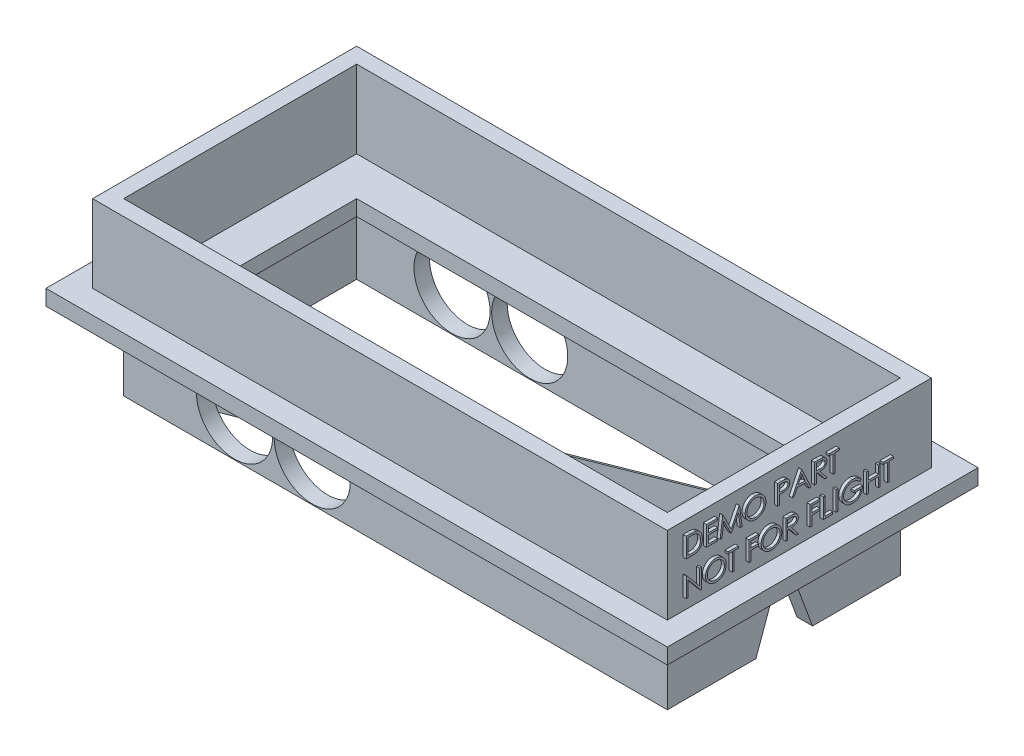
from build123d import *

# Parameters (mm, degrees)
SKETCH1_W           = 350
SKETCH1_H           = 150
SKETCH1_W_2         = 330
SKETCH1_H_2         = 130
BOSS_EXTRUDE1_DEPTH = 50
SKETCH2_W           = 400
SKETCH2_H           = 200
SKETCH2_W_2         = 300
SKETCH2_H_2         = 100
BOSS_EXTRUDE2_DEPTH = 10
SKETCH3_W           = 370
SKETCH3_H           = 170
SKETCH3_W_2         = 350
SKETCH3_H_2         = 150
BOSS_EXTRUDE3_DEPTH = 50
BOSS_EXTRUDE4_DEPTH = 25
SKETCH5_R           = 24.5
CUT_EXTRUDE1_DEPTH  = 25
CUT_EXTRUDE2_START  = -130
SKETCH5_3_R         = 24.5
CUT_EXTRUDE2_DEPTH  = 20
CUT_EXTRUDE3_DEPTH  = 20
SKETCH7_W           = 1.139743589
SKETCH7_H           = 12.7
BOSS_EXTRUDE5_DEPTH = 2


with BuildPart() as part:
    # Sketch1 → Boss-Extrude1 (new body)
    with BuildSketch(Plane(origin=(0, 0, 0), x_dir=(1, 0, 0), z_dir=(0, 1, 0))):
        with Locations((165, 65)):
            Rectangle(SKETCH1_W, SKETCH1_H)
        with Locations((165, 65)):
            Rectangle(SKETCH1_W_2, SKETCH1_H_2, mode=Mode.SUBTRACT)
    extrude(amount=BOSS_EXTRUDE1_DEPTH)

    # Sketch2 → Boss-Extrude2 (add)
    with BuildSketch(Plane(origin=(0, 50, 0), x_dir=(1, 0, 0), z_dir=(0, 1, 0))):
        with Locations((165, 65)):
            Rectangle(SKETCH2_W, SKETCH2_H)
        with Locations((165, 65)):
            Rectangle(SKETCH2_W_2, SKETCH2_H_2, mode=Mode.SUBTRACT)
    extrude(amount=BOSS_EXTRUDE2_DEPTH)

    # Sketch3 → Boss-Extrude3 (add)
    with BuildSketch(Plane(origin=(0, 60, 0), x_dir=(1, 0, 0), z_dir=(0, 1, 0))):
        with Locations((165, 65)):
            Rectangle(SKETCH3_W, SKETCH3_H)
        with Locations((165, 65)):
            Rectangle(SKETCH3_W_2, SKETCH3_H_2, mode=Mode.SUBTRACT)
    extrude(amount=BOSS_EXTRUDE3_DEPTH)

    # Sketch4 → Boss-Extrude4 (add)
    with BuildSketch(Plane.XZ):
        Polygon((0.6988, 0), (330, -129.241932626), (330, -130), (329.194358019, -130), (0, -0.8), (0, 0), align=None)
    extrude(amount=-BOSS_EXTRUDE4_DEPTH)

    # Sketch5 → Cut-Extrude1 (cut)
    with BuildSketch(Plane(origin=(0, 0, -140), x_dir=(-1, 0, 0), z_dir=(0, 0, -1))):
        with Locations((-61.39675889, 24.958245431)):
            Circle(SKETCH5_R)
        with Locations((-111.39675889, 24.958245431)):
            Circle(SKETCH5_R)
    extrude(amount=-CUT_EXTRUDE1_DEPTH, mode=Mode.SUBTRACT)

    # Sketch5<3> → Cut-Extrude2 (cut)
    with BuildSketch(Plane(origin=(0, 0, -140), x_dir=(-1, 0, 0), z_dir=(0, 0, -1)).offset(CUT_EXTRUDE2_START)):
        with Locations((-61.39675889, 24.958245431)):
            Circle(SKETCH5_3_R)
        with Locations((-111.39675889, 24.958245431)):
            Circle(SKETCH5_3_R)
    extrude(amount=-CUT_EXTRUDE2_DEPTH, mode=Mode.SUBTRACT)

    # Sketch6 → Cut-Extrude3 (cut)
    with BuildSketch(Plane(origin=(340, 0, 0), x_dir=(0, 0, -1), z_dir=(1, 0, 0))):
        Polygon((47.05043949, 0), (65, 50), (83.482635595, 0), align=None)
    extrude(amount=-CUT_EXTRUDE3_DEPTH, mode=Mode.SUBTRACT)

    # Sketch7 → Boss-Extrude5 (add)
    # profile 1 of 20: a face of its own
    with BuildSketch(Plane(origin=(350, 0, 0), x_dir=(0, 0, -1), z_dir=(1, 0, 0))):
        with BuildLine():
            Line((-9.81688911, 90.003565289), (-9.81688911, 102.703565289))
            Line((-9.81688911, 102.703565289), (-7.252466033, 102.703565289))
            add(Edge.make_bspline(
                [(-7.252466033, 102.703565289), (-7.029421419, 102.701959392), (-6.598500385, 102.698856808), (-5.975792361, 102.679184903), (-5.399634137, 102.644385212), (-4.87192062, 102.593695789), (-4.391203079, 102.531454781), (-3.958827559, 102.453439028), (-3.572558354, 102.361316239), (-3.334997813, 102.282774176), (-3.222658341, 102.245632597)],
                knots=[0, 0, 0, 0, 1.314313732, 2.53924729, 3.670748893, 4.714932338, 5.66265055, 6.526160246, 7.303039223, 8, 8, 8, 8], degree=3))
            add(Edge.make_bspline(
                [(-3.222658341, 102.245632597), (-3.075720287, 102.189641179), (-2.785176246, 102.078928043), (-2.371493259, 101.870080893), (-1.982055513, 101.633450495), (-1.614774616, 101.368724936), (-1.278040189, 101.068408586), (-0.958697249, 100.74525859), (-0.669809537, 100.387523755), (-0.405256577, 100.002623084), (-0.166730041, 99.595090781), (0.040603474, 99.165703386), (0.212793679, 98.716641517), (0.355734815, 98.24915398), (0.468389104, 97.762212838), (0.545249256, 97.255251095), (0.595943991, 96.730272322), (0.601038691, 96.374039268), (0.60362371, 96.193288847)],
                knots=[0, 0, 0, 0, 0.984719456, 1.947108742, 2.898477687, 3.838006223, 4.779231079, 5.722358779, 6.681677486, 7.655904652, 8.64651281, 9.637519902, 10.640069247, 11.656948941, 12.698408672, 13.768548281, 14.867775369, 16, 16, 16, 16], degree=3))
            add(Edge.make_bspline(
                [(0.60362371, 96.193288847), (0.601341457, 96.036312353), (0.596844038, 95.726973776), (0.556460521, 95.271076812), (0.497763588, 94.82870471), (0.406888927, 94.401964027), (0.296571236, 93.987115922), (0.155187029, 93.588581778), (-0.006776057, 93.20270567), (-0.195642759, 92.834705115), (-0.402984356, 92.486059735), (-0.625494681, 92.157399962), (-0.862936405, 91.853415585), (-1.117573701, 91.57318605), (-1.386115986, 91.317133809), (-1.670321415, 91.083119924), (-1.970923342, 90.875723282), (-2.286575393, 90.686794061), (-2.626485919, 90.521983057), (-2.997093205, 90.382537021), (-3.399977765, 90.266979303), (-3.834150694, 90.170564909), (-4.300362171, 90.094084411), (-4.799069275, 90.042825787), (-5.329505783, 90.008162289), (-5.693739117, 90.005127375), (-5.881212027, 90.003565289)],
                knots=[0, 0, 0, 0, 1.105936401, 2.179363191, 3.223086493, 4.248585256, 5.251745608, 6.245858792, 7.225916811, 8.198733463, 9.158002045, 10.082870192, 10.993790845, 11.873723703, 12.748670949, 13.606408763, 14.465103618, 15.319838547, 16.196477973, 17.123216899, 18.106603292, 19.147568657, 20.255746949, 21.433717677, 22.679120308, 24, 24, 24, 24], degree=3))
            Line((-5.881212027, 90.003565289), (-9.81688911, 90.003565289))
        make_face()
        with BuildLine():
            Line((-8.67714552, 91.306129392), (-7.219393117, 91.306129392))
            add(Edge.make_bspline(
                [(-7.219393117, 91.306129392), (-7.0099216, 91.307029627), (-6.60703116, 91.308761109), (-6.027700713, 91.323954675), (-5.498366903, 91.348781134), (-5.018954568, 91.383524988), (-4.589734395, 91.429493963), (-4.209809359, 91.480747181), (-3.880424851, 91.544600788), (-3.681109465, 91.602479984), (-3.589004495, 91.629226347)],
                knots=[0, 0, 0, 0, 1.375205317, 2.645023457, 3.804390687, 4.853969522, 5.800190428, 6.637939096, 7.370582563, 8, 8, 8, 8], degree=3))
            add(Edge.make_bspline(
                [(-3.589004495, 91.629226347), (-3.473077581, 91.670053429), (-3.243992665, 91.750732441), (-2.914224156, 91.897898812), (-2.606677311, 92.072222893), (-2.315992362, 92.265996859), (-2.046292783, 92.486055209), (-1.794382419, 92.727612797), (-1.560768454, 92.991898981), (-1.347864536, 93.278585738), (-1.157334404, 93.585888711), (-0.9923388, 93.910786765), (-0.847734671, 94.249720048), (-0.734238064, 94.60789328), (-0.645281516, 94.982104435), (-0.582272505, 95.372379838), (-0.543030505, 95.778646603), (-0.538453251, 96.054970026), (-0.536119879, 96.195832917)],
                knots=[0, 0, 0, 0, 0.998632004, 1.973411704, 2.929992603, 3.868527914, 4.809262121, 5.754881198, 6.702106254, 7.672490631, 8.653608572, 9.636854334, 10.631411391, 11.644891563, 12.686317036, 13.754757253, 14.855430412, 16, 16, 16, 16], degree=3))
            add(Edge.make_bspline(
                [(-0.536119879, 96.195832917), (-0.537982379, 96.344362974), (-0.541641277, 96.636151586), (-0.587630917, 97.064289252), (-0.654837704, 97.476061898), (-0.752024222, 97.871497064), (-0.875870554, 98.251366228), (-1.030428254, 98.61356845), (-1.207018558, 98.961928975), (-1.417124952, 99.288407387), (-1.647232962, 99.597173812), (-1.902604125, 99.880038791), (-2.179181236, 100.137646681), (-2.473947689, 100.37400933), (-2.795210878, 100.579617525), (-3.135402842, 100.763537768), (-3.499514277, 100.919624002), (-3.752834631, 101.00264159), (-3.881572604, 101.044831315)],
                knots=[0, 0, 0, 0, 1.122418816, 2.205001699, 3.251619955, 4.274784885, 5.280384055, 6.268708349, 7.249350384, 8.229342522, 9.199999885, 10.157847722, 11.105861043, 12.055065948, 13.010012805, 13.98527497, 14.976112212, 16, 16, 16, 16], degree=3))
            add(Edge.make_bspline(
                [(-3.881572604, 101.044831315), (-3.988075335, 101.074282353), (-4.214529362, 101.136903341), (-4.584061132, 101.20521255), (-4.999950388, 101.26546316), (-5.46404359, 101.31647376), (-5.975811713, 101.353076326), (-6.535648352, 101.380549382), (-7.143795488, 101.399079163), (-7.565372111, 101.400344472), (-7.78417677, 101.401001186)],
                knots=[0, 0, 0, 0, 0.674548936, 1.434276114, 2.292660221, 3.240891867, 4.284742987, 5.42552168, 6.663806718, 8, 8, 8, 8], degree=3))
            Line((-7.78417677, 101.401001186), (-8.67714552, 101.401001186))
            Line((-8.67714552, 101.401001186), (-8.67714552, 91.306129392))
        make_face(mode=Mode.SUBTRACT)
    # profile 2 of 20: a face of its own
    with BuildSketch(Plane(origin=(350, 0, 0), x_dir=(0, 0, -1), z_dir=(1, 0, 0))):
        Polygon((3.208751916, 102.703565289), (10.37285448, 102.703565289), (10.37285448, 101.401001186), (4.348495505, 101.401001186), (4.348495505, 97.493308879), (10.37285448, 97.493308879), (10.37285448, 96.190744776), (4.348495505, 96.190744776), (4.348495505, 91.306129392), (10.37285448, 91.306129392), (10.37285448, 90.003565289), (3.208751916, 90.003565289), align=None)
    # profile 3 of 20: a face of its own
    with BuildSketch(Plane(origin=(350, 0, 0), x_dir=(0, 0, -1), z_dir=(1, 0, 0))):
        Polygon((12.001059608, 90.003565289), (13.677602076, 102.703565289), (13.840422589, 102.703565289), (19.083751916, 92.283052468), (24.31436089, 102.703565289), (24.479725473, 102.703565289), (26.166444223, 90.003565289), (25.021612492, 90.003565289), (23.805546787, 99.141866571), (19.221131723, 90.003565289), (18.964180601, 90.003565289), (14.361957044, 99.162219135), (13.148435409, 90.003565289), align=None)
    # profile 4 of 20: a face of its own
    with BuildSketch(Plane(origin=(350, 0, 0), x_dir=(0, 0, -1), z_dir=(1, 0, 0))):
        with BuildLine():
            add(Edge.make_bspline(
                [(34.714521146, 103.029206315), (34.949681988, 103.023250089), (35.411557282, 103.011551572), (36.090371911, 102.922001682), (36.738416971, 102.76707841), (37.360971475, 102.560747016), (37.950588847, 102.285503961), (38.511707114, 101.952817851), (39.042991199, 101.559203272), (39.537280212, 101.107702935), (39.98960686, 100.616454402), (40.388117933, 100.092205985), (40.72209997, 99.538127474), (40.996368398, 98.955883889), (41.211537639, 98.346792005), (41.360015312, 97.707604623), (41.454859457, 97.042463205), (41.465947563, 96.588794296), (41.471572428, 96.35865343)],
                knots=[0, 0, 0, 0, 1.065120563, 2.091984664, 3.0946048, 4.079830382, 5.057816894, 6.036188127, 7.030412546, 8.04752943, 9.064399622, 10.05169764, 11.02544977, 11.989514704, 12.962713494, 13.945757189, 14.957906945, 16, 16, 16, 16], degree=3))
            add(Edge.make_bspline(
                [(41.471572428, 96.35865343), (41.465948387, 96.130207839), (41.454862751, 95.679915113), (41.359907473, 95.018994616), (41.210987273, 94.383665517), (40.998366536, 93.774988434), (40.725405514, 93.192321274), (40.389199607, 92.637197185), (39.993172928, 92.109434176), (39.542479497, 91.614813934), (39.051167145, 91.161251683), (38.524188748, 90.766031763), (37.973395844, 90.425947082), (37.391700618, 90.154589179), (36.786817627, 89.937702497), (36.153333197, 89.789828668), (35.494215701, 89.694444253), (35.044740916, 89.683491353), (34.816283967, 89.677924263)],
                knots=[0, 0, 0, 0, 1.043624062, 2.057103931, 3.04512605, 4.022047818, 4.998200453, 5.980619268, 6.982898556, 8.009068085, 9.034988726, 10.034168286, 11.015286542, 11.987931943, 12.962482838, 13.94673481, 14.956375938, 16, 16, 16, 16], degree=3))
            add(Edge.make_bspline(
                [(34.816283967, 89.677924263), (34.586144295, 89.683546324), (34.13247774, 89.694628903), (33.466500497, 89.78963), (32.826864113, 89.938188445), (32.215397752, 90.150494114), (31.631760437, 90.424876637), (31.074810708, 90.759446812), (30.546784088, 91.156438439), (30.052058322, 91.606985724), (29.599396946, 92.097465355), (29.204755783, 92.623006795), (28.870110371, 93.173299452), (28.596649136, 93.749870468), (28.380152384, 94.34993256), (28.232452044, 94.977488464), (28.136890161, 95.628960386), (28.125878003, 96.072527474), (28.120290377, 96.297595738)],
                knots=[0, 0, 0, 0, 1.053102029, 2.075944431, 3.073151272, 4.055350789, 5.033113405, 6.020478099, 7.024410459, 8.052272461, 9.079885166, 10.07527673, 11.055994387, 12.023226415, 12.992069828, 13.970394897, 14.97016774, 16, 16, 16, 16], degree=3))
            add(Edge.make_bspline(
                [(28.120290377, 96.297595738), (28.12223034, 96.448662851), (28.126085793, 96.7488913), (28.172501363, 97.194721534), (28.239853821, 97.633381921), (28.336380761, 98.063625075), (28.46262481, 98.484397791), (28.611585024, 98.898601988), (28.793521034, 99.302040071), (28.999190814, 99.696623235), (29.228740803, 100.076200494), (29.482289951, 100.434992124), (29.750932574, 100.776008884), (30.045439745, 101.090413726), (30.356105132, 101.387352994), (30.68796839, 101.662263424), (31.039004533, 101.91762396), (31.410724026, 102.147749198), (31.79396748, 102.355880915), (32.189034645, 102.534485917), (32.590559919, 102.687778769), (33.000423927, 102.812024049), (33.417538272, 102.910111722), (33.842813319, 102.97690412), (34.275910265, 103.023438073), (34.56768848, 103.027275295), (34.714521146, 103.029206315)],
                knots=[0, 0, 0, 0, 1.037015668, 2.060948919, 3.074880161, 4.083647147, 5.086022904, 6.090072063, 7.104153813, 8.122640571, 9.144368836, 10.147691507, 11.138137339, 12.123020368, 13.103399296, 14.087645067, 15.080126199, 16.082011238, 17.087798457, 18.072939717, 19.057185487, 20.037253025, 21.01195951, 21.997135196, 22.992090687, 24, 24, 24, 24], degree=3))
        make_face()
        with BuildLine():
            add(Edge.make_bspline(
                [(34.770490698, 101.726642212), (34.649969027, 101.725173039), (34.410077882, 101.722248738), (34.053445422, 101.683728856), (33.701503262, 101.628828973), (33.354178719, 101.550518883), (33.012925041, 101.443824177), (32.674561331, 101.321030025), (32.342173107, 101.171456353), (32.01685768, 101.002463969), (31.701480122, 100.815415028), (31.403891177, 100.608688901), (31.12332044, 100.387133576), (30.860454872, 100.150231995), (30.616066333, 99.896777725), (30.385344702, 99.630613171), (30.177537935, 99.344130595), (29.98709027, 99.045098548), (29.816664107, 98.733906524), (29.665115534, 98.413830738), (29.541148988, 98.082260275), (29.440048365, 97.742792332), (29.356229052, 97.39596455), (29.303128813, 97.039145898), (29.26418568, 96.674129349), (29.261428526, 96.427452335), (29.260033967, 96.302683879)],
                knots=[0, 0, 0, 0, 1.008559885, 2.007477868, 2.99961109, 3.989939068, 4.984837346, 5.991145699, 7.001802488, 8.033829008, 9.059044045, 10.069351652, 11.065060232, 12.050310815, 13.029377138, 14.011219647, 14.996725999, 15.989392538, 16.977580475, 17.965360261, 18.951710183, 19.937753436, 20.929683414, 21.935841486, 22.955955122, 24, 24, 24, 24], degree=3))
            add(Edge.make_bspline(
                [(29.260033967, 96.302683879), (29.264659894, 96.119215249), (29.273760525, 95.758275696), (29.353435137, 95.229345574), (29.476160587, 94.721025221), (29.657071602, 94.236096007), (29.883315261, 93.770389609), (30.162812835, 93.328037344), (30.493952945, 92.908919657), (30.870103456, 92.515962538), (31.281302991, 92.157293477), (31.717938897, 91.842466251), (32.175333416, 91.576091916), (32.654679323, 91.359084939), (33.153417536, 91.187127891), (33.674761792, 91.069276858), (34.215239174, 90.991714491), (34.583650409, 90.98426592), (34.770490698, 90.980488366)],
                knots=[0, 0, 0, 0, 1.032063989, 2.030389145, 3.003944642, 3.970395727, 4.937377036, 5.913328081, 6.909231446, 7.93887556, 8.970685674, 9.976071282, 10.964166581, 11.944589148, 12.933237628, 13.927779006, 14.949070134, 16, 16, 16, 16], degree=3))
            add(Edge.make_bspline(
                [(34.770490698, 90.980488366), (34.896073746, 90.982213767), (35.14514265, 90.985635757), (35.515603545, 91.020102384), (35.87939037, 91.075372311), (36.235992872, 91.154949261), (36.58500633, 91.25454341), (36.927887473, 91.37286288), (37.260984126, 91.520477533), (37.588498395, 91.683574386), (37.901993329, 91.869502958), (38.201261689, 92.069212815), (38.478760245, 92.29044181), (38.741429161, 92.523823587), (38.986821061, 92.774063835), (39.213276518, 93.040837212), (39.420032998, 93.325827596), (39.610408344, 93.624406069), (39.780237326, 93.936449614), (39.9282072, 94.257685874), (40.053741677, 94.587323842), (40.155082252, 94.925838973), (40.234495213, 95.272588339), (40.289213779, 95.628036222), (40.327489542, 95.991471551), (40.330374537, 96.237284971), (40.331828839, 96.361197501)],
                knots=[0, 0, 0, 0, 1.047197238, 2.076906641, 3.100256066, 4.114471768, 5.12198147, 6.126382909, 7.136867548, 8.15857795, 9.17633901, 10.174870724, 11.156907918, 12.133735059, 13.104061851, 14.077631395, 15.04955518, 16.038496417, 17.029181396, 18.010275684, 18.986308667, 19.968651475, 20.955262928, 21.950658345, 22.966943676, 24, 24, 24, 24], degree=3))
            add(Edge.make_bspline(
                [(40.331828839, 96.361197501), (40.330373371, 96.48426233), (40.327486184, 96.728384089), (40.289232062, 97.089284773), (40.234437403, 97.442174998), (40.155469862, 97.785669369), (40.053687876, 98.119855445), (39.928185277, 98.444419358), (39.780192905, 98.760570238), (39.610345919, 99.067526687), (39.419425645, 99.362075022), (39.210803677, 99.643660919), (38.980877985, 99.906996294), (38.736217837, 100.158582184), (38.470712054, 100.393052812), (38.185563329, 100.610485958), (37.884233413, 100.816128982), (37.565183159, 101.001641735), (37.235912241, 101.172961951), (36.898041593, 101.319741305), (36.55539886, 101.444462996), (36.208855367, 101.550841697), (35.855494274, 101.628522264), (35.497703238, 101.683778331), (35.135977271, 101.722235331), (34.89270616, 101.72516859), (34.770490698, 101.726642212)],
                knots=[0, 0, 0, 0, 1.02996197, 2.043119294, 3.035359645, 4.018872909, 4.991431989, 5.957985074, 6.929999688, 7.912076566, 8.892894881, 9.867085534, 10.843653904, 11.817741046, 12.803660682, 13.806313499, 14.818574707, 15.856120519, 16.894564902, 17.924820532, 18.937903209, 19.946497019, 20.957711757, 21.963978472, 22.977135795, 24, 24, 24, 24], degree=3))
        make_face(mode=Mode.SUBTRACT)
    # profile 5 of 20: a face of its own
    with BuildSketch(Plane(origin=(350, 0, 0), x_dir=(0, 0, -1), z_dir=(1, 0, 0))):
        with BuildLine():
            Line((48.961316018, 102.703565289), (51.45196105, 102.703565289))
            add(Edge.make_bspline(
                [(51.45196105, 102.703565289), (51.623269195, 102.70337698), (51.951503209, 102.703016171), (52.422183554, 102.69207695), (52.84966458, 102.67746581), (53.233024534, 102.657211512), (53.573442947, 102.633275313), (53.869379434, 102.599703628), (54.12316011, 102.564650555), (54.275220655, 102.52901288), (54.344569223, 102.512760001)],
                knots=[0, 0, 0, 0, 1.415646017, 2.712440637, 3.8905458, 4.950247383, 5.884950622, 6.709939814, 7.411656543, 8, 8, 8, 8], degree=3))
            add(Edge.make_bspline(
                [(54.344569223, 102.512760001), (54.432357189, 102.488731783), (54.605864506, 102.441241542), (54.855876862, 102.346123173), (55.093743673, 102.233339317), (55.320281042, 102.104801021), (55.532705172, 101.954993402), (55.734185378, 101.789989132), (55.922943592, 101.605978583), (56.097918357, 101.405025613), (56.258608908, 101.190503709), (56.396965186, 100.959210474), (56.51281541, 100.715039173), (56.612177566, 100.458159644), (56.683691101, 100.186414756), (56.737564137, 99.901692685), (56.771758443, 99.604023952), (56.775033453, 99.400606719), (56.776700633, 99.297054872)],
                knots=[0, 0, 0, 0, 0.999701418, 1.975846123, 2.934577507, 3.890451536, 4.834027766, 5.787354733, 6.749476667, 7.726910423, 8.712836071, 9.690891519, 10.682875813, 11.679750201, 12.712814741, 13.765529915, 14.8625177, 16, 16, 16, 16], degree=3))
            add(Edge.make_bspline(
                [(56.776700633, 99.297054872), (56.775171464, 99.192632654), (56.77217954, 98.98832353), (56.736270162, 98.689427985), (56.687900609, 98.403792683), (56.613525591, 98.132050963), (56.516114148, 97.875816596), (56.401842985, 97.63117384), (56.264017032, 97.402284744), (56.10564865, 97.188318346), (55.929475722, 96.989073807), (55.736243632, 96.805994982), (55.526732485, 96.640153525), (55.301608119, 96.49117765), (55.05867581, 96.362522007), (54.801619996, 96.247288358), (54.528206354, 96.150510509), (54.339003517, 96.099601429), (54.242806403, 96.073717533)],
                knots=[0, 0, 0, 0, 1.121902311, 2.195077645, 3.232258892, 4.234102512, 5.217864754, 6.176164875, 7.132989551, 8.084763148, 9.034132444, 9.988522005, 10.94243251, 11.903244335, 12.886203696, 13.894208494, 14.929344452, 16, 16, 16, 16], degree=3))
            add(Edge.make_bspline(
                [(54.242806403, 96.073717533), (54.163241505, 96.056797573), (53.988870406, 96.019716497), (53.701695385, 95.978320096), (53.367339271, 95.942986517), (52.986258426, 95.916493817), (52.558794914, 95.893813909), (52.084717495, 95.875786825), (51.563095558, 95.865881356), (51.199254186, 95.865370479), (51.009292781, 95.865103751)],
                knots=[0, 0, 0, 0, 0.601384939, 1.31797006, 2.144135048, 3.087295005, 4.142315834, 5.309527816, 6.595305764, 8, 8, 8, 8], degree=3))
            Line((51.009292781, 95.865103751), (50.101059608, 95.865103751))
            Line((50.101059608, 95.865103751), (50.101059608, 90.003565289))
            Line((50.101059608, 90.003565289), (48.961316018, 90.003565289))
            Line((48.961316018, 90.003565289), (48.961316018, 102.703565289))
        make_face()
        with BuildLine():
            Line((50.101059608, 101.401001186), (50.101059608, 97.167667853))
            Line((50.101059608, 97.167667853), (52.324577236, 97.139683077))
            add(Edge.make_bspline(
                [(52.324577236, 97.139683077), (52.433143824, 97.139626967), (52.642729384, 97.139518646), (52.945483679, 97.153979314), (53.226368808, 97.170672675), (53.484521981, 97.195114455), (53.720059572, 97.229663018), (53.93337432, 97.264539895), (54.122812175, 97.314996497), (54.344514993, 97.382934491), (54.591560282, 97.498804267), (54.860319672, 97.666988154), (55.088087229, 97.881366724), (55.285185048, 98.122404855), (55.441597805, 98.390553124), (55.556100977, 98.677460409), (55.623378891, 98.98018432), (55.632400223, 99.18733271), (55.636957044, 99.291966731)],
                knots=[0, 0, 0, 0, 1.160613943, 2.240541288, 3.23993089, 4.169200891, 5.011653406, 5.7853311, 6.478053781, 7.106038997, 8.262395093, 9.384106736, 10.481365981, 11.59014053, 12.70357646, 13.786202915, 14.881775077, 16, 16, 16, 16], degree=3))
            add(Edge.make_bspline(
                [(55.636957044, 99.291966731), (55.632375441, 99.394069337), (55.623267781, 99.597036681), (55.555573649, 99.89450247), (55.441820424, 100.178386311), (55.284135067, 100.443174364), (55.09276011, 100.683345167), (54.870331065, 100.891977599), (54.617371517, 101.059696349), (54.382065078, 101.167948543), (54.17305506, 101.234043971), (53.99151052, 101.280289534), (53.786530073, 101.317212449), (53.558046987, 101.347110073), (53.30783219, 101.372704061), (53.033736019, 101.390070321), (52.736796799, 101.400235605), (52.530655585, 101.400739814), (52.423795986, 101.401001186)],
                knots=[0, 0, 0, 0, 1.120700087, 2.227813068, 3.331159281, 4.466773991, 5.599788987, 6.693661531, 7.80175334, 8.91857717, 9.525282508, 10.207424825, 10.974604443, 11.810962634, 12.737642355, 13.736264703, 14.826523623, 16, 16, 16, 16], degree=3))
            Line((52.423795986, 101.401001186), (50.101059608, 101.401001186))
        make_face(mode=Mode.SUBTRACT)
    # profile 6 of 20: a face of its own
    with BuildSketch(Plane(origin=(350, 0, 0), x_dir=(0, 0, -1), z_dir=(1, 0, 0))):
        Polygon((64.592085249, 102.703565289), (70.45362371, 90.003565289), (69.214661371, 90.003565289), (67.337137332, 94.074078109), (61.579905762, 94.074078109), (59.648956242, 90.003565289), (58.404905762, 90.003565289), (64.429264736, 102.703565289), align=None)
        Polygon((64.49795464, 100.22818468), (62.198114896, 95.376642212), (66.736736691, 95.376642212), align=None, mode=Mode.SUBTRACT)
    # profile 7 of 20: a face of its own
    with BuildSketch(Plane(origin=(350, 0, 0), x_dir=(0, 0, -1), z_dir=(1, 0, 0))):
        with BuildLine():
            Line((72.73311089, 102.703565289), (75.274637332, 102.703565289))
            add(Edge.make_bspline(
                [(75.274637332, 102.703565289), (75.444240856, 102.703000734), (75.769898408, 102.701916726), (76.236435704, 102.695872387), (76.66035117, 102.678548296), (77.041423158, 102.663640007), (77.379644678, 102.636454963), (77.676052847, 102.610472043), (77.929282492, 102.576459046), (78.082574581, 102.544870797), (78.151981082, 102.530568494)],
                knots=[0, 0, 0, 0, 1.410062039, 2.707475311, 3.878576406, 4.937260626, 5.877586885, 6.699081471, 7.410979367, 8, 8, 8, 8], degree=3))
            add(Edge.make_bspline(
                [(78.151981082, 102.530568494), (78.244896547, 102.507611374), (78.428745337, 102.462186872), (78.693449863, 102.36617632), (78.945687552, 102.255070825), (79.184410629, 102.124573897), (79.408423357, 101.973716839), (79.620035514, 101.805103938), (79.820207338, 101.619657791), (80.000843539, 101.412702795), (80.171165241, 101.195581746), (80.3148154, 100.960799542), (80.438645769, 100.715284857), (80.537235931, 100.456540798), (80.61662172, 100.187076654), (80.672596931, 99.904451592), (80.706165527, 99.609953197), (80.709583117, 99.40908307), (80.711316018, 99.307231154)],
                knots=[0, 0, 0, 0, 1.027469482, 2.033020251, 3.019912614, 3.986113645, 4.951240523, 5.91722682, 6.890402269, 7.87763091, 8.8651537, 9.85103654, 10.82876324, 11.815024772, 12.821070561, 13.842952187, 14.906261191, 16, 16, 16, 16], degree=3))
            add(Edge.make_bspline(
                [(80.711316018, 99.307231154), (80.705985653, 99.138012346), (80.695584732, 98.807822623), (80.598610784, 98.328630282), (80.439764555, 97.881629054), (80.220877192, 97.467381768), (79.942132238, 97.093963141), (79.607125138, 96.765974917), (79.215669005, 96.491510091), (78.851254059, 96.301181343), (78.529348249, 96.179287074), (78.264341656, 96.093520858), (77.975264338, 96.027256013), (77.66488601, 95.967892106), (77.331915031, 95.9230731), (76.97714946, 95.890246886), (76.600336281, 95.869730767), (76.341477372, 95.866675492), (76.20831121, 95.865103751)],
                knots=[0, 0, 0, 0, 1.260483769, 2.459530307, 3.627416485, 4.787058657, 5.939039949, 7.08810263, 8.267026773, 9.491475466, 10.141966685, 10.831826277, 11.566392101, 12.351337768, 13.187381173, 14.07005841, 15.007169909, 16, 16, 16, 16], degree=3))
            Line((76.20831121, 95.865103751), (80.874136531, 90.003565289))
            Line((80.874136531, 90.003565289), (79.464721467, 90.003565289))
            Line((79.464721467, 90.003565289), (74.798896146, 95.865103751))
            Line((74.798896146, 95.865103751), (73.87285448, 95.865103751))
            Line((73.87285448, 95.865103751), (73.87285448, 90.003565289))
            Line((73.87285448, 90.003565289), (72.73311089, 90.003565289))
            Line((72.73311089, 90.003565289), (72.73311089, 102.703565289))
        make_face()
        with BuildLine():
            Line((73.87285448, 101.401001186), (73.87285448, 97.167667853))
            Line((73.87285448, 97.167667853), (76.198134928, 97.149859359))
            add(Edge.make_bspline(
                [(76.198134928, 97.149859359), (76.306701927, 97.149811329), (76.517135691, 97.149718233), (76.821575246, 97.164209936), (77.105039652, 97.18069569), (77.366444667, 97.205911887), (77.605907068, 97.238409633), (77.823307168, 97.279060462), (78.018999842, 97.326420803), (78.247231681, 97.399723845), (78.502089952, 97.515859969), (78.779064107, 97.684826207), (79.014929732, 97.897348439), (79.214203118, 98.140366408), (79.374329912, 98.407560797), (79.487222224, 98.695728765), (79.558859086, 98.997595421), (79.567308379, 99.205070269), (79.571572428, 99.309775225)],
                knots=[0, 0, 0, 0, 1.146690395, 2.22261258, 3.21895312, 4.145990853, 4.996080663, 5.770904154, 6.481378293, 7.121626537, 8.300444488, 9.431385265, 10.535395872, 11.636531494, 12.74115979, 13.810798291, 14.895190096, 16, 16, 16, 16], degree=3))
            add(Edge.make_bspline(
                [(79.571572428, 99.309775225), (79.567210446, 99.411907078), (79.558566589, 99.614295144), (79.487995343, 99.910589447), (79.368653874, 100.190232381), (79.207827467, 100.452086369), (79.011887677, 100.68977861), (78.782134471, 100.893149709), (78.524849905, 101.060969195), (78.284380128, 101.168209376), (78.069444557, 101.233958557), (77.882828362, 101.280227066), (77.671966715, 101.317399853), (77.435835765, 101.347183388), (77.175443562, 101.372782758), (76.889473485, 101.390024926), (76.579822882, 101.400235233), (76.365204018, 101.400739927), (76.25410448, 101.401001186)],
                knots=[0, 0, 0, 0, 1.101028733, 2.181837193, 3.264309656, 4.369019818, 5.486613113, 6.575447106, 7.666700264, 8.788928104, 9.402425223, 10.0903467, 10.862060571, 11.710948788, 12.657782767, 13.684531032, 14.801375019, 16, 16, 16, 16], degree=3))
            Line((76.25410448, 101.401001186), (73.87285448, 101.401001186))
        make_face(mode=Mode.SUBTRACT)
    # profile 8 of 20: a face of its own
    with BuildSketch(Plane(origin=(350, 0, 0), x_dir=(0, 0, -1), z_dir=(1, 0, 0))):
        Polygon((82.013880121, 101.401001186), (82.013880121, 102.703565289), (88.689521146, 102.703565289), (88.689521146, 101.401001186), (85.921572428, 101.401001186), (85.921572428, 90.003565289), (84.781828839, 90.003565289), (84.781828839, 101.401001186), align=None)
    # profile 9 of 20: a face of its own
    with BuildSketch(Plane(origin=(350, 0, 0), x_dir=(0, 0, -1), z_dir=(1, 0, 0))):
        Polygon((-9.81688911, 67.836898622), (-9.81688911, 80.536898622), (-9.577746482, 80.536898622), (-1.187401931, 70.541245577), (-1.187401931, 80.536898622), (-0.047658341, 80.536898622), (-0.047658341, 67.836898622), (-0.307153533, 67.836898622), (-8.67714552, 77.809655033), (-8.67714552, 67.836898622), align=None)
    # profile 10 of 20: a face of its own
    with BuildSketch(Plane(origin=(350, 0, 0), x_dir=(0, 0, -1), z_dir=(1, 0, 0))):
        with BuildLine():
            add(Edge.make_bspline(
                [(9.151700633, 80.862539648), (9.386861475, 80.856583423), (9.848736769, 80.844884905), (10.527551398, 80.755335015), (11.175596458, 80.600411743), (11.798150962, 80.394080349), (12.387768334, 80.118837294), (12.948886601, 79.786151184), (13.480170686, 79.392536605), (13.974459699, 78.941036268), (14.426786347, 78.449787735), (14.82529742, 77.925539319), (15.159279457, 77.371460807), (15.433547885, 76.789217222), (15.648717126, 76.180125338), (15.797194799, 75.540937957), (15.892038944, 74.875796538), (15.90312705, 74.422127629), (15.908751916, 74.191986763)],
                knots=[0, 0, 0, 0, 1.065120563, 2.091984664, 3.0946048, 4.079830382, 5.057816894, 6.036188127, 7.030412546, 8.04752943, 9.064399622, 10.05169764, 11.02544977, 11.989514704, 12.962713494, 13.945757189, 14.957906945, 16, 16, 16, 16], degree=3))
            add(Edge.make_bspline(
                [(15.908751916, 74.191986763), (15.903127875, 73.963541172), (15.892042239, 73.513248447), (15.79708696, 72.852327949), (15.64816676, 72.216998851), (15.435546023, 71.608321768), (15.162585001, 71.025654608), (14.826379094, 70.470530518), (14.430352415, 69.94276751), (13.979658984, 69.448147267), (13.488346632, 68.994585016), (12.961368235, 68.599365096), (12.410575332, 68.259280415), (11.828880105, 67.987922513), (11.223997114, 67.77103583), (10.590512685, 67.623162001), (9.931395188, 67.527777587), (9.481920403, 67.516824686), (9.253463454, 67.511257597)],
                knots=[0, 0, 0, 0, 1.043624062, 2.057103931, 3.04512605, 4.022047818, 4.998200453, 5.980619268, 6.982898556, 8.009068085, 9.034988726, 10.034168286, 11.015286542, 11.987931943, 12.962482838, 13.94673481, 14.956375938, 16, 16, 16, 16], degree=3))
            add(Edge.make_bspline(
                [(9.253463454, 67.511257597), (9.023323782, 67.516879658), (8.569657227, 67.527962236), (7.903679985, 67.622963334), (7.2640436, 67.771521779), (6.65257724, 67.983827447), (6.068939924, 68.25820997), (5.511990195, 68.592780146), (4.983963575, 68.989771772), (4.489237809, 69.440319057), (4.036576433, 69.930798689), (3.64193527, 70.456340129), (3.307289859, 71.006632786), (3.033828624, 71.583203802), (2.817331871, 72.183265894), (2.669631531, 72.810821798), (2.574069648, 73.462293719), (2.56305749, 73.905860807), (2.557469864, 74.130929071)],
                knots=[0, 0, 0, 0, 1.053102029, 2.075944431, 3.073151272, 4.055350789, 5.033113405, 6.020478099, 7.024410459, 8.052272461, 9.079885166, 10.07527673, 11.055994387, 12.023226415, 12.992069828, 13.970394897, 14.97016774, 16, 16, 16, 16], degree=3))
            add(Edge.make_bspline(
                [(2.557469864, 74.130929071), (2.559409827, 74.281996185), (2.56326528, 74.582224633), (2.60968085, 75.028054868), (2.677033309, 75.466715254), (2.773560248, 75.896958409), (2.899804297, 76.317731124), (3.048764511, 76.731935321), (3.230700521, 77.135373404), (3.436370301, 77.529956569), (3.66592029, 77.909533827), (3.919469438, 78.268325457), (4.188112061, 78.609342217), (4.482619232, 78.923747059), (4.793284619, 79.220686327), (5.125147877, 79.495596757), (5.476184021, 79.750957294), (5.847903513, 79.981082531), (6.231146968, 80.189214248), (6.626214133, 80.36781925), (7.027739406, 80.521112102), (7.437603415, 80.645357382), (7.854717759, 80.743445056), (8.279992806, 80.810237453), (8.713089753, 80.856771407), (9.004867967, 80.860608628), (9.151700633, 80.862539648)],
                knots=[0, 0, 0, 0, 1.037015668, 2.060948919, 3.074880161, 4.083647147, 5.086022904, 6.090072063, 7.104153813, 8.122640571, 9.144368836, 10.147691507, 11.138137339, 12.123020368, 13.103399296, 14.087645067, 15.080126199, 16.082011238, 17.087798457, 18.072939717, 19.057185487, 20.037253025, 21.01195951, 21.997135196, 22.992090687, 24, 24, 24, 24], degree=3))
        make_face()
        with BuildLine():
            add(Edge.make_bspline(
                [(9.207670185, 79.559975545), (9.087148514, 79.558506372), (8.847257369, 79.555582071), (8.490624909, 79.517062189), (8.138682749, 79.462162306), (7.791358206, 79.383852216), (7.450104528, 79.277157511), (7.111740818, 79.154363358), (6.779352594, 79.004789687), (6.454037167, 78.835797302), (6.138659609, 78.648748361), (5.841070664, 78.442022235), (5.560499927, 78.220466909), (5.297634359, 77.983565328), (5.05324582, 77.730111059), (4.822524189, 77.463946505), (4.614717422, 77.177463929), (4.424269757, 76.878431881), (4.253843594, 76.567239858), (4.102295021, 76.247164072), (3.978328475, 75.915593608), (3.877227852, 75.576125665), (3.793408539, 75.229297883), (3.7403083, 74.872479231), (3.701365167, 74.507462682), (3.698608014, 74.260785669), (3.697213454, 74.136017212)],
                knots=[0, 0, 0, 0, 1.008559885, 2.007477868, 2.99961109, 3.989939068, 4.984837346, 5.991145699, 7.001802488, 8.033829008, 9.059044045, 10.069351652, 11.065060232, 12.050310815, 13.029377138, 14.011219647, 14.996725999, 15.989392538, 16.977580475, 17.965360261, 18.951710183, 19.937753436, 20.929683414, 21.935841486, 22.955955122, 24, 24, 24, 24], degree=3))
            add(Edge.make_bspline(
                [(3.697213454, 74.136017212), (3.701839382, 73.952548582), (3.710940012, 73.59160903), (3.790614624, 73.062678908), (3.913340074, 72.554358554), (4.09425109, 72.06942934), (4.320494748, 71.603722943), (4.599992322, 71.161370677), (4.931132432, 70.74225299), (5.307282943, 70.349295871), (5.718482478, 69.99062681), (6.155118384, 69.675799585), (6.612512903, 69.40942525), (7.09185881, 69.192418273), (7.590597023, 69.020461224), (8.111941279, 68.902610191), (8.652418661, 68.825047824), (9.020829896, 68.817599253), (9.207670185, 68.813821699)],
                knots=[0, 0, 0, 0, 1.032063989, 2.030389145, 3.003944642, 3.970395727, 4.937377036, 5.913328081, 6.909231446, 7.93887556, 8.970685674, 9.976071282, 10.964166581, 11.944589148, 12.933237628, 13.927779006, 14.949070134, 16, 16, 16, 16], degree=3))
            add(Edge.make_bspline(
                [(9.207670185, 68.813821699), (9.333253233, 68.815547101), (9.582322137, 68.81896909), (9.952783032, 68.853435718), (10.316569858, 68.908705644), (10.673172359, 68.988282594), (11.022185817, 69.087876743), (11.36506696, 69.206196213), (11.698163614, 69.353810867), (12.025677882, 69.516907719), (12.339172816, 69.702836291), (12.638441176, 69.902546148), (12.915939732, 70.123775144), (13.178608648, 70.357156921), (13.424000548, 70.607397168), (13.650456005, 70.874170545), (13.857212485, 71.15916093), (14.047587831, 71.457739402), (14.217416813, 71.769782947), (14.365386687, 72.091019207), (14.490921164, 72.420657176), (14.592261739, 72.759172306), (14.6716747, 73.105921672), (14.726393266, 73.461369556), (14.764669029, 73.824804884), (14.767554024, 74.070618304), (14.769008326, 74.194530834)],
                knots=[0, 0, 0, 0, 1.047197238, 2.076906641, 3.100256066, 4.114471768, 5.12198147, 6.126382909, 7.136867548, 8.15857795, 9.17633901, 10.174870724, 11.156907918, 12.133735059, 13.104061851, 14.077631395, 15.04955518, 16.038496417, 17.029181396, 18.010275684, 18.986308667, 19.968651475, 20.955262928, 21.950658345, 22.966943676, 24, 24, 24, 24], degree=3))
            add(Edge.make_bspline(
                [(14.769008326, 74.194530834), (14.767552859, 74.317595664), (14.764665672, 74.561717423), (14.726411549, 74.922618107), (14.67161689, 75.275508331), (14.592649349, 75.619002702), (14.490867363, 75.953188779), (14.365364764, 76.277752692), (14.217372392, 76.593903571), (14.047525406, 76.90086002), (13.856605132, 77.195408355), (13.647983164, 77.476994252), (13.418057472, 77.740329628), (13.173397325, 77.991915517), (12.907891541, 78.226386145), (12.622742816, 78.443819292), (12.3214129, 78.649462316), (12.002362646, 78.834975069), (11.673091728, 79.006295284), (11.33522108, 79.153074639), (10.992578348, 79.277796329), (10.646034854, 79.384175031), (10.292673761, 79.461855597), (9.934882725, 79.517111664), (9.573156758, 79.555568664), (9.329885647, 79.558501923), (9.207670185, 79.559975545)],
                knots=[0, 0, 0, 0, 1.02996197, 2.043119294, 3.035359645, 4.018872909, 4.991431989, 5.957985074, 6.929999688, 7.912076566, 8.892894881, 9.867085534, 10.843653904, 11.817741046, 12.803660682, 13.806313499, 14.818574707, 15.856120519, 16.894564902, 17.924820532, 18.937903209, 19.946497019, 20.957711757, 21.963978472, 22.977135795, 24, 24, 24, 24], degree=3))
        make_face(mode=Mode.SUBTRACT)
    # profile 11 of 20: a face of its own
    with BuildSketch(Plane(origin=(350, 0, 0), x_dir=(0, 0, -1), z_dir=(1, 0, 0))):
        Polygon((17.048495505, 79.23433452), (17.048495505, 80.536898622), (23.724136531, 80.536898622), (23.724136531, 79.23433452), (20.956187813, 79.23433452), (20.956187813, 67.836898622), (19.816444223, 67.836898622), (19.816444223, 79.23433452), align=None)
    # profile 12 of 20: a face of its own
    with BuildSketch(Plane(origin=(350, 0, 0), x_dir=(0, 0, -1), z_dir=(1, 0, 0))):
        Polygon((30.562598069, 80.536898622), (36.749777557, 80.536898622), (36.749777557, 79.23433452), (31.702341659, 79.23433452), (31.702341659, 75.326642212), (36.749777557, 75.326642212), (36.749777557, 74.024078109), (31.702341659, 74.024078109), (31.702341659, 67.836898622), (30.562598069, 67.836898622), align=None)
    # profile 13 of 20: a face of its own
    with BuildSketch(Plane(origin=(350, 0, 0), x_dir=(0, 0, -1), z_dir=(1, 0, 0))):
        with BuildLine():
            add(Edge.make_bspline(
                [(44.972213454, 80.862539648), (45.207374295, 80.856583423), (45.66924959, 80.844884905), (46.348064219, 80.755335015), (46.996109279, 80.600411743), (47.618663782, 80.394080349), (48.208281154, 80.118837294), (48.769399422, 79.786151184), (49.300683507, 79.392536605), (49.79497252, 78.941036268), (50.247299168, 78.449787735), (50.645810241, 77.925539319), (50.979792278, 77.371460807), (51.254060706, 76.789217222), (51.469229947, 76.180125338), (51.617707619, 75.540937957), (51.712551764, 74.875796538), (51.723639871, 74.422127629), (51.729264736, 74.191986763)],
                knots=[0, 0, 0, 0, 1.065120563, 2.091984664, 3.0946048, 4.079830382, 5.057816894, 6.036188127, 7.030412546, 8.04752943, 9.064399622, 10.05169764, 11.02544977, 11.989514704, 12.962713494, 13.945757189, 14.957906945, 16, 16, 16, 16], degree=3))
            add(Edge.make_bspline(
                [(51.729264736, 74.191986763), (51.723640695, 73.963541172), (51.712555059, 73.513248447), (51.617599781, 72.852327949), (51.468679581, 72.216998851), (51.256058843, 71.608321768), (50.983097821, 71.025654608), (50.646891915, 70.470530518), (50.250865236, 69.94276751), (49.800171805, 69.448147267), (49.308859452, 68.994585016), (48.781881056, 68.599365096), (48.231088152, 68.259280415), (47.649392925, 67.987922513), (47.044509935, 67.77103583), (46.411025505, 67.623162001), (45.751908009, 67.527777587), (45.302433224, 67.516824686), (45.073976274, 67.511257597)],
                knots=[0, 0, 0, 0, 1.043624062, 2.057103931, 3.04512605, 4.022047818, 4.998200453, 5.980619268, 6.982898556, 8.009068085, 9.034988726, 10.034168286, 11.015286542, 11.987931943, 12.962482838, 13.94673481, 14.956375938, 16, 16, 16, 16], degree=3))
            add(Edge.make_bspline(
                [(45.073976274, 67.511257597), (44.843836603, 67.516879658), (44.390170048, 67.527962236), (43.724192805, 67.622963334), (43.08455642, 67.771521779), (42.47309006, 67.983827447), (41.889452744, 68.25820997), (41.332503016, 68.592780146), (40.804476396, 68.989771772), (40.30975063, 69.440319057), (39.857089254, 69.930798689), (39.46244809, 70.456340129), (39.127802679, 71.006632786), (38.854341444, 71.583203802), (38.637844692, 72.183265894), (38.490144351, 72.810821798), (38.394582468, 73.462293719), (38.383570311, 73.905860807), (38.377982685, 74.130929071)],
                knots=[0, 0, 0, 0, 1.053102029, 2.075944431, 3.073151272, 4.055350789, 5.033113405, 6.020478099, 7.024410459, 8.052272461, 9.079885166, 10.07527673, 11.055994387, 12.023226415, 12.992069828, 13.970394897, 14.97016774, 16, 16, 16, 16], degree=3))
            add(Edge.make_bspline(
                [(38.377982685, 74.130929071), (38.379922648, 74.281996185), (38.383778101, 74.582224633), (38.43019367, 75.028054868), (38.497546129, 75.466715254), (38.594073069, 75.896958409), (38.720317118, 76.317731124), (38.869277331, 76.731935321), (39.051213342, 77.135373404), (39.256883122, 77.529956569), (39.486433111, 77.909533827), (39.739982259, 78.268325457), (40.008624882, 78.609342217), (40.303132053, 78.923747059), (40.61379744, 79.220686327), (40.945660697, 79.495596757), (41.296696841, 79.750957294), (41.668416333, 79.981082531), (42.051659788, 80.189214248), (42.446726953, 80.36781925), (42.848252227, 80.521112102), (43.258116235, 80.645357382), (43.675230579, 80.743445056), (44.100505626, 80.810237453), (44.533602573, 80.856771407), (44.825380788, 80.860608628), (44.972213454, 80.862539648)],
                knots=[0, 0, 0, 0, 1.037015668, 2.060948919, 3.074880161, 4.083647147, 5.086022904, 6.090072063, 7.104153813, 8.122640571, 9.144368836, 10.147691507, 11.138137339, 12.123020368, 13.103399296, 14.087645067, 15.080126199, 16.082011238, 17.087798457, 18.072939717, 19.057185487, 20.037253025, 21.01195951, 21.997135196, 22.992090687, 24, 24, 24, 24], degree=3))
        make_face()
        with BuildLine():
            add(Edge.make_bspline(
                [(45.028183005, 79.559975545), (44.907661335, 79.558506372), (44.66777019, 79.555582071), (44.31113773, 79.517062189), (43.95919557, 79.462162306), (43.611871027, 79.383852216), (43.270617348, 79.277157511), (42.932253639, 79.154363358), (42.599865415, 79.004789687), (42.274549988, 78.835797302), (41.959172429, 78.648748361), (41.661583484, 78.442022235), (41.381012748, 78.220466909), (41.11814718, 77.983565328), (40.873758641, 77.730111059), (40.64303701, 77.463946505), (40.435230242, 77.177463929), (40.244782578, 76.878431881), (40.074356414, 76.567239858), (39.922807842, 76.247164072), (39.798841295, 75.915593608), (39.697740673, 75.576125665), (39.613921359, 75.229297883), (39.56082112, 74.872479231), (39.521877988, 74.507462682), (39.519120834, 74.260785669), (39.517726274, 74.136017212)],
                knots=[0, 0, 0, 0, 1.008559885, 2.007477868, 2.99961109, 3.989939068, 4.984837346, 5.991145699, 7.001802488, 8.033829008, 9.059044045, 10.069351652, 11.065060232, 12.050310815, 13.029377138, 14.011219647, 14.996725999, 15.989392538, 16.977580475, 17.965360261, 18.951710183, 19.937753436, 20.929683414, 21.935841486, 22.955955122, 24, 24, 24, 24], degree=3))
            add(Edge.make_bspline(
                [(39.517726274, 74.136017212), (39.522352202, 73.952548582), (39.531452833, 73.59160903), (39.611127445, 73.062678908), (39.733852895, 72.554358554), (39.91476391, 72.06942934), (40.141007569, 71.603722943), (40.420505142, 71.161370677), (40.751645253, 70.74225299), (41.127795764, 70.349295871), (41.538995299, 69.99062681), (41.975631205, 69.675799585), (42.433025723, 69.40942525), (42.91237163, 69.192418273), (43.411109843, 69.020461224), (43.9324541, 68.902610191), (44.472931482, 68.825047824), (44.841342716, 68.817599253), (45.028183005, 68.813821699)],
                knots=[0, 0, 0, 0, 1.032063989, 2.030389145, 3.003944642, 3.970395727, 4.937377036, 5.913328081, 6.909231446, 7.93887556, 8.970685674, 9.976071282, 10.964166581, 11.944589148, 12.933237628, 13.927779006, 14.949070134, 16, 16, 16, 16], degree=3))
            add(Edge.make_bspline(
                [(45.028183005, 68.813821699), (45.153766054, 68.815547101), (45.402834957, 68.81896909), (45.773295853, 68.853435718), (46.137082678, 68.908705644), (46.493685179, 68.988282594), (46.842698638, 69.087876743), (47.185579781, 69.206196213), (47.518676434, 69.353810867), (47.846190703, 69.516907719), (48.159685637, 69.702836291), (48.458953997, 69.902546148), (48.736452552, 70.123775144), (48.999121469, 70.357156921), (49.244513369, 70.607397168), (49.470968826, 70.874170545), (49.677725305, 71.15916093), (49.868100652, 71.457739402), (50.037929634, 71.769782947), (50.185899507, 72.091019207), (50.311433985, 72.420657176), (50.412774559, 72.759172306), (50.49218752, 73.105921672), (50.546906087, 73.461369556), (50.58518185, 73.824804884), (50.588066844, 74.070618304), (50.589521146, 74.194530834)],
                knots=[0, 0, 0, 0, 1.047197238, 2.076906641, 3.100256066, 4.114471768, 5.12198147, 6.126382909, 7.136867548, 8.15857795, 9.17633901, 10.174870724, 11.156907918, 12.133735059, 13.104061851, 14.077631395, 15.04955518, 16.038496417, 17.029181396, 18.010275684, 18.986308667, 19.968651475, 20.955262928, 21.950658345, 22.966943676, 24, 24, 24, 24], degree=3))
            add(Edge.make_bspline(
                [(50.589521146, 74.194530834), (50.588065679, 74.317595664), (50.585178492, 74.561717423), (50.54692437, 74.922618107), (50.492129711, 75.275508331), (50.41316217, 75.619002702), (50.311380184, 75.953188779), (50.185877585, 76.277752692), (50.037885212, 76.593903571), (49.868038227, 76.90086002), (49.677117953, 77.195408355), (49.468495984, 77.476994252), (49.238570293, 77.740329628), (48.993910145, 77.991915517), (48.728404361, 78.226386145), (48.443255637, 78.443819292), (48.141925721, 78.649462316), (47.822875466, 78.834975069), (47.493604548, 79.006295284), (47.155733901, 79.153074639), (46.813091168, 79.277796329), (46.466547675, 79.384175031), (46.113186582, 79.461855597), (45.755395546, 79.517111664), (45.393669579, 79.555568664), (45.150398467, 79.558501923), (45.028183005, 79.559975545)],
                knots=[0, 0, 0, 0, 1.02996197, 2.043119294, 3.035359645, 4.018872909, 4.991431989, 5.957985074, 6.929999688, 7.912076566, 8.892894881, 9.867085534, 10.843653904, 11.817741046, 12.803660682, 13.806313499, 14.818574707, 15.856120519, 16.894564902, 17.924820532, 18.937903209, 19.946497019, 20.957711757, 21.963978472, 22.977135795, 24, 24, 24, 24], degree=3))
        make_face(mode=Mode.SUBTRACT)
    # profile 14 of 20: a face of its own
    with BuildSketch(Plane(origin=(350, 0, 0), x_dir=(0, 0, -1), z_dir=(1, 0, 0))):
        with BuildLine():
            Line((54.334392941, 80.536898622), (56.875919383, 80.536898622))
            add(Edge.make_bspline(
                [(56.875919383, 80.536898622), (57.045522907, 80.536334067), (57.371180459, 80.53525006), (57.837717755, 80.52920572), (58.261633221, 80.511881629), (58.642705209, 80.496973341), (58.980926729, 80.469788296), (59.277334898, 80.443805377), (59.530564543, 80.409792379), (59.683856632, 80.37820413), (59.753263133, 80.363901827)],
                knots=[0, 0, 0, 0, 1.410062039, 2.707475311, 3.878576406, 4.937260626, 5.877586885, 6.699081471, 7.410979367, 8, 8, 8, 8], degree=3))
            add(Edge.make_bspline(
                [(59.753263133, 80.363901827), (59.846178598, 80.340944707), (60.030027389, 80.295520205), (60.294731914, 80.199509653), (60.546969604, 80.088404158), (60.78569268, 79.95790723), (61.009705409, 79.807050173), (61.221317565, 79.638437271), (61.421489389, 79.452991125), (61.60212559, 79.246036128), (61.772447292, 79.028915079), (61.916097451, 78.794132876), (62.03992782, 78.54861819), (62.138517982, 78.289874131), (62.217903771, 78.020409988), (62.273878983, 77.737784925), (62.307447578, 77.44328653), (62.310865168, 77.242416404), (62.312598069, 77.140564488)],
                knots=[0, 0, 0, 0, 1.027469482, 2.033020251, 3.019912614, 3.986113645, 4.951240523, 5.91722682, 6.890402269, 7.87763091, 8.8651537, 9.85103654, 10.82876324, 11.815024772, 12.821070561, 13.842952187, 14.906261191, 16, 16, 16, 16], degree=3))
            add(Edge.make_bspline(
                [(62.312598069, 77.140564488), (62.307267705, 76.97134568), (62.296866783, 76.641155956), (62.199892835, 76.161963615), (62.041046607, 75.714962388), (61.822159244, 75.300715101), (61.543414289, 74.927296474), (61.20840719, 74.59930825), (60.816951057, 74.324843425), (60.45253611, 74.134514676), (60.1306303, 74.012620408), (59.865623708, 73.926854191), (59.576546389, 73.860589346), (59.266168061, 73.801225439), (58.933197082, 73.756406434), (58.578431511, 73.72358022), (58.201618332, 73.7030641), (57.942759423, 73.700008825), (57.809593262, 73.698437084)],
                knots=[0, 0, 0, 0, 1.260483769, 2.459530307, 3.627416485, 4.787058657, 5.939039949, 7.08810263, 8.267026773, 9.491475466, 10.141966685, 10.831826277, 11.566392101, 12.351337768, 13.187381173, 14.07005841, 15.007169909, 16, 16, 16, 16], degree=3))
            Line((57.809593262, 73.698437084), (62.475418582, 67.836898622))
            Line((62.475418582, 67.836898622), (61.066003518, 67.836898622))
            Line((61.066003518, 67.836898622), (56.400178198, 73.698437084))
            Line((56.400178198, 73.698437084), (55.474136531, 73.698437084))
            Line((55.474136531, 73.698437084), (55.474136531, 67.836898622))
            Line((55.474136531, 67.836898622), (54.334392941, 67.836898622))
            Line((54.334392941, 67.836898622), (54.334392941, 80.536898622))
        make_face()
        with BuildLine():
            Line((55.474136531, 79.23433452), (55.474136531, 75.001001186))
            Line((55.474136531, 75.001001186), (57.79941698, 74.983192693))
            add(Edge.make_bspline(
                [(57.79941698, 74.983192693), (57.907983978, 74.983144663), (58.118417742, 74.983051567), (58.422857298, 74.997543269), (58.706321703, 75.014029024), (58.967726718, 75.03924522), (59.20718912, 75.071742966), (59.424589219, 75.112393795), (59.620281893, 75.159754136), (59.848513733, 75.233057179), (60.103372003, 75.349193302), (60.380346158, 75.51815954), (60.616211783, 75.730681773), (60.81548517, 75.973699742), (60.975611964, 76.24089413), (61.088504275, 76.529062099), (61.160141137, 76.830928754), (61.168590431, 77.038403603), (61.17285448, 77.143108558)],
                knots=[0, 0, 0, 0, 1.146690395, 2.22261258, 3.21895312, 4.145990853, 4.996080663, 5.770904154, 6.481378293, 7.121626537, 8.300444488, 9.431385265, 10.535395872, 11.636531494, 12.74115979, 13.810798291, 14.895190096, 16, 16, 16, 16], degree=3))
            add(Edge.make_bspline(
                [(61.17285448, 77.143108558), (61.168492497, 77.245240411), (61.15984864, 77.447628478), (61.089277394, 77.743922781), (60.969935925, 78.023565714), (60.809109519, 78.285419702), (60.613169728, 78.523111944), (60.383416522, 78.726483042), (60.126131957, 78.894302528), (59.88566218, 79.001542709), (59.670726609, 79.067291891), (59.484110414, 79.113560399), (59.273248766, 79.150733187), (59.037117816, 79.180516722), (58.776725613, 79.206116091), (58.490755536, 79.223358259), (58.181104933, 79.233568566), (57.966486069, 79.23407326), (57.855386531, 79.23433452)],
                knots=[0, 0, 0, 0, 1.101028733, 2.181837193, 3.264309656, 4.369019818, 5.486613113, 6.575447106, 7.666700264, 8.788928104, 9.402425223, 10.0903467, 10.862060571, 11.710948788, 12.657782767, 13.684531032, 14.801375019, 16, 16, 16, 16], degree=3))
            Line((57.855386531, 79.23433452), (55.474136531, 79.23433452))
        make_face(mode=Mode.SUBTRACT)
    # profile 15 of 20: a face of its own
    with BuildSketch(Plane(origin=(350, 0, 0), x_dir=(0, 0, -1), z_dir=(1, 0, 0))):
        Polygon((69.965162172, 80.536898622), (76.152341659, 80.536898622), (76.152341659, 79.23433452), (71.104905762, 79.23433452), (71.104905762, 75.326642212), (76.152341659, 75.326642212), (76.152341659, 74.024078109), (71.104905762, 74.024078109), (71.104905762, 67.836898622), (69.965162172, 67.836898622), align=None)
    # profile 16 of 20: a face of its own
    with BuildSketch(Plane(origin=(350, 0, 0), x_dir=(0, 0, -1), z_dir=(1, 0, 0))):
        Polygon((78.431828839, 80.536898622), (79.571572428, 80.536898622), (79.571572428, 69.139462725), (84.456187813, 69.139462725), (84.456187813, 67.836898622), (78.431828839, 67.836898622), align=None)
    # profile 17 of 20: a face of its own
    with BuildSketch(Plane(origin=(350, 0, 0), x_dir=(0, 0, -1), z_dir=(1, 0, 0))):
        with Locations((87.142726275, 74.186898622)):
            Rectangle(SKETCH7_W, SKETCH7_H)
    # profile 18 of 20: a face of its own
    with BuildSketch(Plane(origin=(350, 0, 0), x_dir=(0, 0, -1), z_dir=(1, 0, 0))):
        with BuildLine():
            Line((102.854905762, 78.369350545), (101.877982685, 77.443308879))
            add(Edge.make_bspline(
                [(101.877982685, 77.443308879), (101.701202719, 77.609609439), (101.351858208, 77.938245027), (100.782316756, 78.364642067), (100.188088712, 78.729916201), (99.572274795, 79.027118831), (98.950125185, 79.26425599), (98.329897911, 79.433086671), (97.717954938, 79.540755592), (97.310948174, 79.553631104), (97.110394544, 79.559975545)],
                knots=[0, 0, 0, 0, 1.08915593, 2.152340314, 3.188132944, 4.216796309, 5.218260357, 6.173443236, 7.099959455, 8, 8, 8, 8], degree=3))
            add(Edge.make_bspline(
                [(97.110394544, 79.559975545), (96.987332632, 79.558474747), (96.741527977, 79.555477042), (96.376414065, 79.517216604), (96.015129411, 79.462189812), (95.658356023, 79.382572141), (95.305400212, 79.281664982), (94.957489546, 79.155443444), (94.61397503, 79.008285844), (94.278092393, 78.83824201), (93.952462566, 78.65144371), (93.644916334, 78.444439006), (93.35349343, 78.22386254), (93.083671315, 77.984191843), (92.833897923, 77.727597903), (92.598228116, 77.458853907), (92.3849505, 77.170617542), (92.192305416, 76.868191985), (92.0204504, 76.556888898), (91.868744715, 76.239704621), (91.741392423, 75.917691207), (91.640628971, 75.590444582), (91.557496027, 75.260496441), (91.499012138, 74.92556217), (91.466040318, 74.58528314), (91.460337002, 74.357418803), (91.457469864, 74.242868174)],
                knots=[0, 0, 0, 0, 1.02818874, 2.053710826, 3.065248034, 4.081641283, 5.106893873, 6.131558223, 7.173050175, 8.228653731, 9.27666206, 10.308777013, 11.325269123, 12.329503258, 13.32196095, 14.316845687, 15.314881793, 16.315733098, 17.311955233, 18.285320748, 19.252783886, 20.203351036, 21.145449891, 22.095197417, 23.042428769, 24, 24, 24, 24], degree=3))
            add(Edge.make_bspline(
                [(91.457469864, 74.242868174), (91.460212042, 74.125771208), (91.465688909, 73.89189703), (91.500742069, 73.542849967), (91.56579597, 73.198986935), (91.652764514, 72.859177995), (91.761552045, 72.522841181), (91.897161433, 72.191434646), (92.057782326, 71.864970655), (92.243697815, 71.54639073), (92.447573468, 71.236064332), (92.675966933, 70.943748353), (92.918575336, 70.665550218), (93.184237201, 70.407646732), (93.464433826, 70.163139451), (93.767536656, 69.938764843), (94.087585584, 69.730201004), (94.425068895, 69.540076491), (94.776324706, 69.370228376), (95.136484924, 69.219193096), (95.506700141, 69.094808072), (95.885024758, 68.993432666), (96.271007772, 68.910337302), (96.666608428, 68.856879445), (97.068917969, 68.818087001), (97.340112434, 68.815250655), (97.476740698, 68.813821699)],
                knots=[0, 0, 0, 0, 0.93586088, 1.869166235, 2.799637598, 3.729985548, 4.670839027, 5.622275134, 6.589130586, 7.576015415, 8.568469353, 9.55398029, 10.53834874, 11.515998671, 12.510579167, 13.508179873, 14.527009472, 15.561807829, 16.601455013, 17.643573243, 18.680854198, 19.719860599, 20.772568776, 21.833555941, 22.908541556, 24, 24, 24, 24], degree=3))
            add(Edge.make_bspline(
                [(97.476740698, 68.813821699), (97.641399272, 68.817263676), (97.964733134, 68.824022557), (98.440026797, 68.876637893), (98.896512225, 68.958813401), (99.332906734, 69.079158226), (99.749717181, 69.232660133), (100.148471568, 69.417700535), (100.526030444, 69.641376778), (100.883528816, 69.893830524), (101.212847747, 70.175098631), (101.509861283, 70.478608511), (101.769832058, 70.802886924), (101.996634824, 71.146023925), (102.184263369, 71.510859746), (102.338270083, 71.895606473), (102.456319455, 72.300437159), (102.504778936, 72.580169651), (102.529264736, 72.721514007)],
                knots=[0, 0, 0, 0, 1.13008108, 2.219097802, 3.278683437, 4.311054135, 5.322181354, 6.324827112, 7.324222904, 8.330512327, 9.32562643, 10.293043162, 11.24128371, 12.174520618, 13.111833804, 14.052305215, 15.015860969, 16, 16, 16, 16], degree=3))
            Line((102.529264736, 72.721514007), (98.295931403, 72.721514007))
            Line((98.295931403, 72.721514007), (98.295931403, 74.024078109))
            Line((98.295931403, 74.024078109), (103.669008326, 74.024078109))
            add(Edge.make_bspline(
                [(103.669008326, 74.024078109), (103.662818533, 73.781299507), (103.650703991, 73.306137927), (103.565726782, 72.613188659), (103.428506866, 71.958697086), (103.241053735, 71.34197394), (102.998392003, 70.763893189), (102.703125972, 70.223867903), (102.35052999, 69.725386804), (101.95316353, 69.26438042), (101.507212255, 68.853157278), (101.02472612, 68.491730018), (100.504907977, 68.187283385), (99.948249533, 67.939594696), (99.356573103, 67.7462862), (98.728509554, 67.609229336), (98.064910603, 67.527114898), (97.610117518, 67.516623321), (97.377521948, 67.511257597)],
                knots=[0, 0, 0, 0, 1.140356446, 2.231883559, 3.274166699, 4.278491846, 5.25512956, 6.21435461, 7.1637429, 8.11826594, 9.068280886, 10.0076534, 10.945064095, 11.891975133, 12.864533718, 13.863980011, 14.907571808, 16, 16, 16, 16], degree=3))
            add(Edge.make_bspline(
                [(97.377521948, 67.511257597), (97.234156599, 67.513322694), (96.951393926, 67.517395731), (96.533778273, 67.546342106), (96.127677193, 67.590903054), (95.733149846, 67.658195359), (95.348745005, 67.740617104), (94.976382511, 67.846160341), (94.614643904, 67.968329621), (94.26297007, 68.107288208), (93.924553001, 68.268293934), (93.597885353, 68.447217483), (93.281161411, 68.643136249), (92.976538613, 68.85943846), (92.682429758, 69.094506244), (92.400731262, 69.34881075), (92.129866105, 69.621574528), (91.960192423, 69.815264077), (91.874697428, 69.912860161)],
                knots=[0, 0, 0, 0, 1.107784379, 2.184907829, 3.233506516, 4.263428166, 5.276301166, 6.270063455, 7.25232949, 8.225834625, 9.190232166, 10.146266622, 11.1027726, 12.066435141, 13.031522626, 14.010570082, 14.99756817, 16, 16, 16, 16], degree=3))
            add(Edge.make_bspline(
                [(91.874697428, 69.912860161), (91.750651332, 70.067693673), (91.504618178, 70.374790621), (91.187923153, 70.866824705), (90.917952348, 71.376282884), (90.698903393, 71.904583392), (90.52785948, 72.451232079), (90.405191077, 73.015530421), (90.333318914, 73.598205081), (90.322964649, 73.992504755), (90.317726274, 74.191986763)],
                knots=[0, 0, 0, 0, 1.023165419, 2.029347347, 3.013907458, 3.994755782, 4.975994455, 5.96558838, 6.970761222, 8, 8, 8, 8], degree=3))
            add(Edge.make_bspline(
                [(90.317726274, 74.191986763), (90.319657539, 74.341361452), (90.323495522, 74.638212367), (90.370033823, 75.078928883), (90.436804683, 75.511819966), (90.534946852, 75.936531756), (90.658667584, 76.353347903), (90.813075948, 76.762461943), (90.992853142, 77.164115306), (91.201806228, 77.555543341), (91.434341266, 77.931551925), (91.686709209, 78.290627383), (91.962493701, 78.626230561), (92.257191031, 78.942611685), (92.574317252, 79.235796073), (92.910901447, 79.508498132), (93.267203005, 79.761083663), (93.644342858, 79.989574206), (94.036691885, 80.194819343), (94.443309604, 80.37475734), (94.864071892, 80.523468228), (95.295826454, 80.649647371), (95.741841385, 80.742956595), (96.198880047, 80.8106249), (96.66932474, 80.856927647), (96.987318332, 80.86065149), (97.148555601, 80.862539648)],
                knots=[0, 0, 0, 0, 1.008945113, 2.00506715, 2.99143336, 3.967273523, 4.948097931, 5.927297278, 6.919902385, 7.919676788, 8.923139349, 9.905703106, 10.883022732, 11.856032218, 12.825136022, 13.798837087, 14.781400844, 15.773989409, 16.776158564, 17.77167057, 18.775803737, 19.789618931, 20.80898985, 21.851988756, 22.910860228, 24, 24, 24, 24], degree=3))
            add(Edge.make_bspline(
                [(97.148555601, 80.862539648), (97.280048657, 80.860436921), (97.540783934, 80.85626746), (97.928771591, 80.827367165), (98.310762244, 80.781560511), (98.687322288, 80.719051885), (99.057169388, 80.633912208), (99.421357148, 80.532028147), (99.780413494, 80.413403534), (100.133213141, 80.27192972), (100.482128282, 80.111352281), (100.82909896, 79.93060072), (101.172939652, 79.726584274), (101.514246642, 79.49869716), (101.855172184, 79.250853329), (102.190323886, 78.975964283), (102.527791712, 78.684870283), (102.744786867, 78.475566359), (102.854905762, 78.369350545)],
                knots=[0, 0, 0, 0, 0.985871117, 1.954866573, 2.915460327, 3.869826059, 4.81536089, 5.759505086, 6.70452669, 7.649098992, 8.607881297, 9.583363685, 10.581137262, 11.603961102, 12.659522466, 13.73993555, 14.853081303, 16, 16, 16, 16], degree=3))
        make_face()
    # profile 19 of 20: a face of its own
    with BuildSketch(Plane(origin=(350, 0, 0), x_dir=(0, 0, -1), z_dir=(1, 0, 0))):
        Polygon((106.274136531, 80.536898622), (107.413880121, 80.536898622), (107.413880121, 75.326642212), (113.926700633, 75.326642212), (113.926700633, 80.536898622), (115.066444223, 80.536898622), (115.066444223, 67.836898622), (113.926700633, 67.836898622), (113.926700633, 74.024078109), (107.413880121, 74.024078109), (107.413880121, 67.836898622), (106.274136531, 67.836898622), align=None)
    # profile 20 of 20: a face of its own
    with BuildSketch(Plane(origin=(350, 0, 0), x_dir=(0, 0, -1), z_dir=(1, 0, 0))):
        Polygon((116.857469864, 79.23433452), (116.857469864, 80.536898622), (123.53311089, 80.536898622), (123.53311089, 79.23433452), (120.765162172, 79.23433452), (120.765162172, 67.836898622), (119.625418582, 67.836898622), (119.625418582, 79.23433452), align=None)
    extrude(amount=BOSS_EXTRUDE5_DEPTH)


solid = part.part
